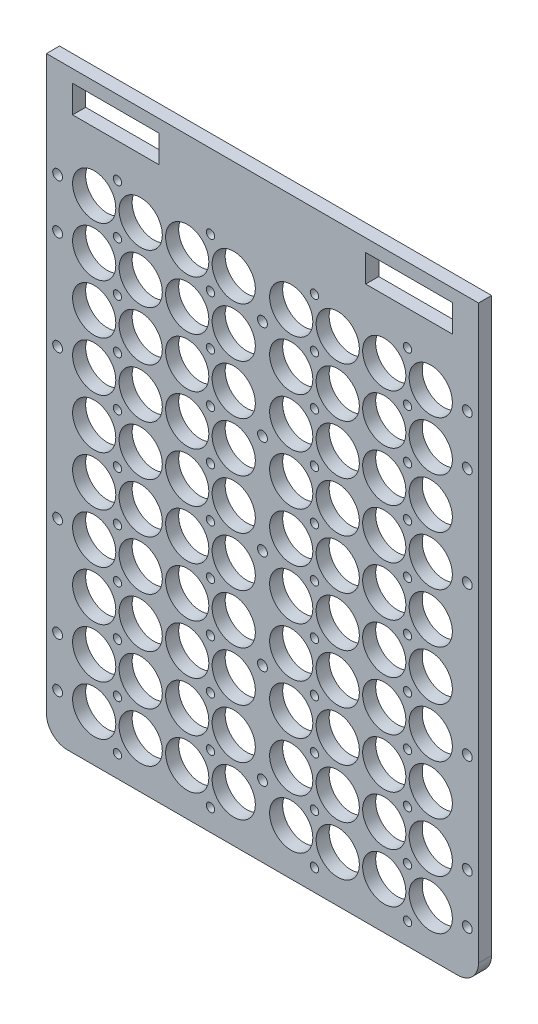
from build123d import *

# Parameters (mm, degrees)
SKETCH1_W            = 209.976
SKETCH1_H            = 266.785000002
SKETCH1_R            = 10.5
SKETCH1_R_2          = 1.527369009
SKETCH1_R_3          = 2.032
SKETCH1_R_4          = 1.43035462
BOSS_EXTRUDE1_DEPTH  = 6.35
M4_CLEARANCE_HOLE1_D = 4.8
FILLET1_R            = 10.16
SKETCH6_W            = 42.120528761
SKETCH6_H            = 13.288973182
BOSS_EXTRUDE2_DEPTH  = 6.35


with BuildPart() as part:
    # Sketch1 → Boss-Extrude1 (new body)
    with BuildSketch(Plane.XY):
        with Locations((81.788, 110.787499999)):
            Rectangle(SKETCH1_W, SKETCH1_H)
        Circle(SKETCH1_R, mode=Mode.SUBTRACT)
        with Locations((22.606, 0)):
            Circle(SKETCH1_R, mode=Mode.SUBTRACT)
        with Locations((45.212, 0)):
            Circle(SKETCH1_R, mode=Mode.SUBTRACT)
        with Locations((67.818, 0)):
            Circle(SKETCH1_R, mode=Mode.SUBTRACT)
        with Locations((22.606, 24.13)):
            Circle(SKETCH1_R, mode=Mode.SUBTRACT)
        with Locations((45.212, 24.13)):
            Circle(SKETCH1_R, mode=Mode.SUBTRACT)
        with Locations((67.818, 24.13)):
            Circle(SKETCH1_R, mode=Mode.SUBTRACT)
        with Locations((22.606, 48.26)):
            Circle(SKETCH1_R, mode=Mode.SUBTRACT)
        with Locations((45.212, 48.26)):
            Circle(SKETCH1_R, mode=Mode.SUBTRACT)
        with Locations((67.818, 48.26)):
            Circle(SKETCH1_R, mode=Mode.SUBTRACT)
        with Locations((22.606, 72.39)):
            Circle(SKETCH1_R, mode=Mode.SUBTRACT)
        with Locations((45.212, 72.39)):
            Circle(SKETCH1_R, mode=Mode.SUBTRACT)
        with Locations((67.818, 72.39)):
            Circle(SKETCH1_R, mode=Mode.SUBTRACT)
        with Locations((22.606, 96.52)):
            Circle(SKETCH1_R, mode=Mode.SUBTRACT)
        with Locations((45.212, 96.52)):
            Circle(SKETCH1_R, mode=Mode.SUBTRACT)
        with Locations((67.818, 96.52)):
            Circle(SKETCH1_R, mode=Mode.SUBTRACT)
        with Locations((22.606, 120.65)):
            Circle(SKETCH1_R, mode=Mode.SUBTRACT)
        with Locations((45.212, 120.65)):
            Circle(SKETCH1_R, mode=Mode.SUBTRACT)
        with Locations((67.818, 120.65)):
            Circle(SKETCH1_R, mode=Mode.SUBTRACT)
        with Locations((22.606, 144.78)):
            Circle(SKETCH1_R, mode=Mode.SUBTRACT)
        with Locations((45.212, 144.78)):
            Circle(SKETCH1_R, mode=Mode.SUBTRACT)
        with Locations((67.818, 144.78)):
            Circle(SKETCH1_R, mode=Mode.SUBTRACT)
        with Locations((22.606, 168.91)):
            Circle(SKETCH1_R, mode=Mode.SUBTRACT)
        with Locations((45.212, 168.91)):
            Circle(SKETCH1_R, mode=Mode.SUBTRACT)
        with Locations((67.818, 168.91)):
            Circle(SKETCH1_R, mode=Mode.SUBTRACT)
        with Locations((22.606, 193.04)):
            Circle(SKETCH1_R, mode=Mode.SUBTRACT)
        with Locations((45.212, 193.04)):
            Circle(SKETCH1_R, mode=Mode.SUBTRACT)
        with Locations((67.818, 193.04)):
            Circle(SKETCH1_R, mode=Mode.SUBTRACT)
        with Locations((22.606, 217.17)):
            Circle(SKETCH1_R, mode=Mode.SUBTRACT)
        with Locations((45.212, 217.17)):
            Circle(SKETCH1_R, mode=Mode.SUBTRACT)
        with Locations((67.818, 217.17)):
            Circle(SKETCH1_R, mode=Mode.SUBTRACT)
        with Locations((0, 24.13)):
            Circle(SKETCH1_R, mode=Mode.SUBTRACT)
        with Locations((0, 48.26)):
            Circle(SKETCH1_R, mode=Mode.SUBTRACT)
        with Locations((0, 72.39)):
            Circle(SKETCH1_R, mode=Mode.SUBTRACT)
        with Locations((0, 96.52)):
            Circle(SKETCH1_R, mode=Mode.SUBTRACT)
        with Locations((0, 120.65)):
            Circle(SKETCH1_R, mode=Mode.SUBTRACT)
        with Locations((0, 144.78)):
            Circle(SKETCH1_R, mode=Mode.SUBTRACT)
        with Locations((0, 168.91)):
            Circle(SKETCH1_R, mode=Mode.SUBTRACT)
        with Locations((0, 193.04)):
            Circle(SKETCH1_R, mode=Mode.SUBTRACT)
        with Locations((0, 217.17)):
            Circle(SKETCH1_R, mode=Mode.SUBTRACT)
        with Locations((95.758, 0)):
            Circle(SKETCH1_R, mode=Mode.SUBTRACT)
        with Locations((118.364, 0)):
            Circle(SKETCH1_R, mode=Mode.SUBTRACT)
        with Locations((140.97, 0)):
            Circle(SKETCH1_R, mode=Mode.SUBTRACT)
        with Locations((163.576, 0)):
            Circle(SKETCH1_R, mode=Mode.SUBTRACT)
        with Locations((118.364, 24.13)):
            Circle(SKETCH1_R, mode=Mode.SUBTRACT)
        with Locations((140.97, 24.13)):
            Circle(SKETCH1_R, mode=Mode.SUBTRACT)
        with Locations((163.576, 24.13)):
            Circle(SKETCH1_R, mode=Mode.SUBTRACT)
        with Locations((118.364, 48.26)):
            Circle(SKETCH1_R, mode=Mode.SUBTRACT)
        with Locations((140.97, 48.26)):
            Circle(SKETCH1_R, mode=Mode.SUBTRACT)
        with Locations((163.576, 48.26)):
            Circle(SKETCH1_R, mode=Mode.SUBTRACT)
        with Locations((118.364, 72.39)):
            Circle(SKETCH1_R, mode=Mode.SUBTRACT)
        with Locations((140.97, 72.39)):
            Circle(SKETCH1_R, mode=Mode.SUBTRACT)
        with Locations((163.576, 72.39)):
            Circle(SKETCH1_R, mode=Mode.SUBTRACT)
        with Locations((118.364, 96.52)):
            Circle(SKETCH1_R, mode=Mode.SUBTRACT)
        with Locations((140.97, 96.52)):
            Circle(SKETCH1_R, mode=Mode.SUBTRACT)
        with Locations((163.576, 96.52)):
            Circle(SKETCH1_R, mode=Mode.SUBTRACT)
        with Locations((118.364, 120.65)):
            Circle(SKETCH1_R, mode=Mode.SUBTRACT)
        with Locations((140.97, 120.65)):
            Circle(SKETCH1_R, mode=Mode.SUBTRACT)
        with Locations((163.576, 120.65)):
            Circle(SKETCH1_R, mode=Mode.SUBTRACT)
        with Locations((118.364, 144.78)):
            Circle(SKETCH1_R, mode=Mode.SUBTRACT)
        with Locations((140.97, 144.78)):
            Circle(SKETCH1_R, mode=Mode.SUBTRACT)
        with Locations((163.576, 144.78)):
            Circle(SKETCH1_R, mode=Mode.SUBTRACT)
        with Locations((118.364, 168.91)):
            Circle(SKETCH1_R, mode=Mode.SUBTRACT)
        with Locations((140.97, 168.91)):
            Circle(SKETCH1_R, mode=Mode.SUBTRACT)
        with Locations((163.576, 168.91)):
            Circle(SKETCH1_R, mode=Mode.SUBTRACT)
        with Locations((118.364, 193.04)):
            Circle(SKETCH1_R, mode=Mode.SUBTRACT)
        with Locations((140.97, 193.04)):
            Circle(SKETCH1_R, mode=Mode.SUBTRACT)
        with Locations((163.576, 193.04)):
            Circle(SKETCH1_R, mode=Mode.SUBTRACT)
        with Locations((118.364, 217.17)):
            Circle(SKETCH1_R, mode=Mode.SUBTRACT)
        with Locations((140.97, 217.17)):
            Circle(SKETCH1_R, mode=Mode.SUBTRACT)
        with Locations((163.576, 217.17)):
            Circle(SKETCH1_R, mode=Mode.SUBTRACT)
        with Locations((95.758, 24.13)):
            Circle(SKETCH1_R, mode=Mode.SUBTRACT)
        with Locations((95.758, 48.26)):
            Circle(SKETCH1_R, mode=Mode.SUBTRACT)
        with Locations((95.758, 72.39)):
            Circle(SKETCH1_R, mode=Mode.SUBTRACT)
        with Locations((95.758, 96.52)):
            Circle(SKETCH1_R, mode=Mode.SUBTRACT)
        with Locations((95.758, 120.65)):
            Circle(SKETCH1_R, mode=Mode.SUBTRACT)
        with Locations((95.758, 144.78)):
            Circle(SKETCH1_R, mode=Mode.SUBTRACT)
        with Locations((95.758, 168.91)):
            Circle(SKETCH1_R, mode=Mode.SUBTRACT)
        with Locations((95.758, 193.04)):
            Circle(SKETCH1_R, mode=Mode.SUBTRACT)
        with Locations((95.758, 217.17)):
            Circle(SKETCH1_R, mode=Mode.SUBTRACT)
        with Locations((-17.769999938, 0)):
            Circle(SKETCH1_R_2, mode=Mode.SUBTRACT)
        with Locations((-17.769999938, 24.13)):
            Circle(SKETCH1_R_2, mode=Mode.SUBTRACT)
        with Locations((-17.769999938, 72.39)):
            Circle(SKETCH1_R_2, mode=Mode.SUBTRACT)
        with Locations((-17.769999938, 144.78)):
            Circle(SKETCH1_R_2, mode=Mode.SUBTRACT)
        with Locations((-17.769999938, 193.04)):
            Circle(SKETCH1_R_2, mode=Mode.SUBTRACT)
        with Locations((-17.769999938, 217.17)):
            Circle(SKETCH1_R_2, mode=Mode.SUBTRACT)
        with Locations(Location((181.345999938, 144.78, 0), (0, 0, 180))):
            Circle(SKETCH1_R_2, mode=Mode.SUBTRACT)
        with Locations(Location((181.345999938, 72.39, 0), (0, 0, 180))):
            Circle(SKETCH1_R_2, mode=Mode.SUBTRACT)
        with Locations(Location((181.345999938, 0, 0), (0, 0, 180))):
            Circle(SKETCH1_R_2, mode=Mode.SUBTRACT)
        with Locations(Location((181.345999938, 217.17, 0), (0, 0, 180))):
            Circle(SKETCH1_R_2, mode=Mode.SUBTRACT)
        with Locations((11.303, 12.065)):
            Circle(SKETCH1_R_3, mode=Mode.SUBTRACT)
        with Locations((56.515, 12.065)):
            Circle(SKETCH1_R_3, mode=Mode.SUBTRACT)
        with Locations((56.515, 36.195)):
            Circle(SKETCH1_R_3, mode=Mode.SUBTRACT)
        with Locations((56.515, 60.325)):
            Circle(SKETCH1_R_3, mode=Mode.SUBTRACT)
        with Locations((56.515, 84.455)):
            Circle(SKETCH1_R_3, mode=Mode.SUBTRACT)
        with Locations((56.515, 108.585)):
            Circle(SKETCH1_R_3, mode=Mode.SUBTRACT)
        with Locations((56.515, 132.715)):
            Circle(SKETCH1_R_3, mode=Mode.SUBTRACT)
        with Locations((56.515, 156.845)):
            Circle(SKETCH1_R_3, mode=Mode.SUBTRACT)
        with Locations((56.515, 180.975)):
            Circle(SKETCH1_R_3, mode=Mode.SUBTRACT)
        with Locations((56.515, 205.105)):
            Circle(SKETCH1_R_3, mode=Mode.SUBTRACT)
        with Locations((56.515, 229.235)):
            Circle(SKETCH1_R_3, mode=Mode.SUBTRACT)
        with Locations((11.303, 36.195)):
            Circle(SKETCH1_R_3, mode=Mode.SUBTRACT)
        with Locations((11.303, 60.325)):
            Circle(SKETCH1_R_3, mode=Mode.SUBTRACT)
        with Locations((11.303, 84.455)):
            Circle(SKETCH1_R_3, mode=Mode.SUBTRACT)
        with Locations((11.303, 108.585)):
            Circle(SKETCH1_R_3, mode=Mode.SUBTRACT)
        with Locations((11.303, 132.715)):
            Circle(SKETCH1_R_3, mode=Mode.SUBTRACT)
        with Locations((11.303, 156.845)):
            Circle(SKETCH1_R_3, mode=Mode.SUBTRACT)
        with Locations((11.303, 180.975)):
            Circle(SKETCH1_R_3, mode=Mode.SUBTRACT)
        with Locations((11.303, 205.105)):
            Circle(SKETCH1_R_3, mode=Mode.SUBTRACT)
        with Locations((11.303, 229.235)):
            Circle(SKETCH1_R_3, mode=Mode.SUBTRACT)
        with Locations((56.515, -12.065)):
            Circle(SKETCH1_R_3, mode=Mode.SUBTRACT)
        with Locations((11.303, -12.065)):
            Circle(SKETCH1_R_3, mode=Mode.SUBTRACT)
        with Locations(Location((107.061, 229.235, 0), (0, 0, 180))):
            Circle(SKETCH1_R_3, mode=Mode.SUBTRACT)
        with Locations(Location((152.273, 229.235, 0), (0, 0, 180))):
            Circle(SKETCH1_R_3, mode=Mode.SUBTRACT)
        with Locations(Location((152.273, 205.105, 0), (0, 0, 180))):
            Circle(SKETCH1_R_3, mode=Mode.SUBTRACT)
        with Locations(Location((107.061, 205.105, 0), (0, 0, 180))):
            Circle(SKETCH1_R_3, mode=Mode.SUBTRACT)
        with Locations(Location((107.061, 180.975, 0), (0, 0, 180))):
            Circle(SKETCH1_R_3, mode=Mode.SUBTRACT)
        with Locations(Location((152.273, 180.975, 0), (0, 0, 180))):
            Circle(SKETCH1_R_3, mode=Mode.SUBTRACT)
        with Locations(Location((152.273, 156.845, 0), (0, 0, 180))):
            Circle(SKETCH1_R_3, mode=Mode.SUBTRACT)
        with Locations(Location((107.061, 156.845, 0), (0, 0, 180))):
            Circle(SKETCH1_R_3, mode=Mode.SUBTRACT)
        with Locations(Location((107.061, 132.715, 0), (0, 0, 180))):
            Circle(SKETCH1_R_3, mode=Mode.SUBTRACT)
        with Locations(Location((152.273, 132.715, 0), (0, 0, 180))):
            Circle(SKETCH1_R_3, mode=Mode.SUBTRACT)
        with Locations(Location((152.273, 108.585, 0), (0, 0, 180))):
            Circle(SKETCH1_R_3, mode=Mode.SUBTRACT)
        with Locations(Location((107.061, 108.585, 0), (0, 0, 180))):
            Circle(SKETCH1_R_3, mode=Mode.SUBTRACT)
        with Locations(Location((107.061, 84.455, 0), (0, 0, 180))):
            Circle(SKETCH1_R_3, mode=Mode.SUBTRACT)
        with Locations(Location((152.273, 84.455, 0), (0, 0, 180))):
            Circle(SKETCH1_R_3, mode=Mode.SUBTRACT)
        with Locations(Location((152.273, 60.325, 0), (0, 0, 180))):
            Circle(SKETCH1_R_3, mode=Mode.SUBTRACT)
        with Locations(Location((107.061, 60.325, 0), (0, 0, 180))):
            Circle(SKETCH1_R_3, mode=Mode.SUBTRACT)
        with Locations(Location((107.061, 36.195, 0), (0, 0, 180))):
            Circle(SKETCH1_R_3, mode=Mode.SUBTRACT)
        with Locations(Location((152.273, 36.195, 0), (0, 0, 180))):
            Circle(SKETCH1_R_3, mode=Mode.SUBTRACT)
        with Locations(Location((152.273, 12.065, 0), (0, 0, 180))):
            Circle(SKETCH1_R_3, mode=Mode.SUBTRACT)
        with Locations(Location((107.061, 12.065, 0), (0, 0, 180))):
            Circle(SKETCH1_R_3, mode=Mode.SUBTRACT)
        with Locations(Location((107.061, -12.065, 0), (0, 0, 180))):
            Circle(SKETCH1_R_3, mode=Mode.SUBTRACT)
        with Locations(Location((152.273, -12.065, 0), (0, 0, 180))):
            Circle(SKETCH1_R_3, mode=Mode.SUBTRACT)
        with Locations(Location((181.345999938, 24.13, 0), (0, 0, 180))):
            Circle(SKETCH1_R_2, mode=Mode.SUBTRACT)
        with Locations(Location((181.345999938, 193.04, 0), (0, 0, 180))):
            Circle(SKETCH1_R_2, mode=Mode.SUBTRACT)
        with Locations((81.788, 12.065)):
            Circle(SKETCH1_R_4, mode=Mode.SUBTRACT)
        with Locations((81.788, 60.325)):
            Circle(SKETCH1_R_4, mode=Mode.SUBTRACT)
        with Locations((81.788, 108.585)):
            Circle(SKETCH1_R_4, mode=Mode.SUBTRACT)
        with Locations((81.788, 156.845)):
            Circle(SKETCH1_R_4, mode=Mode.SUBTRACT)
        with Locations((81.788, 205.105)):
            Circle(SKETCH1_R_4, mode=Mode.SUBTRACT)
    extrude(amount=BOSS_EXTRUDE1_DEPTH)

    # M4 Clearance Hole1 (through all)
    with Locations(Plane.XY.offset(6.35)):
        with Locations((-17.769999938, 217.17), (-17.769999938, 144.78), (-17.769999938, 72.39), (-17.769999938, 0), (181.345999938, 0), (181.345999938, 72.39), (181.345999938, 144.78), (181.345999938, 217.17), (181.345999938, 24.13), (-17.769999938, 24.13), (-17.769999938, 193.04), (181.345999938, 193.04), (81.788, 12.065), (81.788, 60.325), (81.788, 108.585), (81.788, 156.845), (81.788, 205.105)):
            Hole(M4_CLEARANCE_HOLE1_D / 2)

    # Fillet1
    fillet1_edges = [part.edges().sort_by_distance(p)[0] for p in [
        (186.776, -22.605000002, 3.175),
        (-23.2, -22.605000002, 3.175),
    ]]
    fillet(fillet1_edges, radius=FILLET1_R)

    # Sketch6 → Boss-Extrude2 (add, through all)
    with BuildSketch(Plane.XY.offset(6.35)):
        Polygon((-23.2, 244.18), (-23.2, 265.38646), (186.776, 265.38646), (186.776, 244.18), (174.076, 244.18), (107.807082465, 244.18), (55.768917535, 244.18), (-10.5, 244.18), align=None)
        with Locations((10.560264381, 252.583093731)):
            Rectangle(SKETCH6_W, SKETCH6_H, mode=Mode.SUBTRACT)
        with Locations((153.01573562, 252.583093731)):
            Rectangle(SKETCH6_W, SKETCH6_H, mode=Mode.SUBTRACT)
    extrude(amount=-BOSS_EXTRUDE2_DEPTH)


solid = part.part
